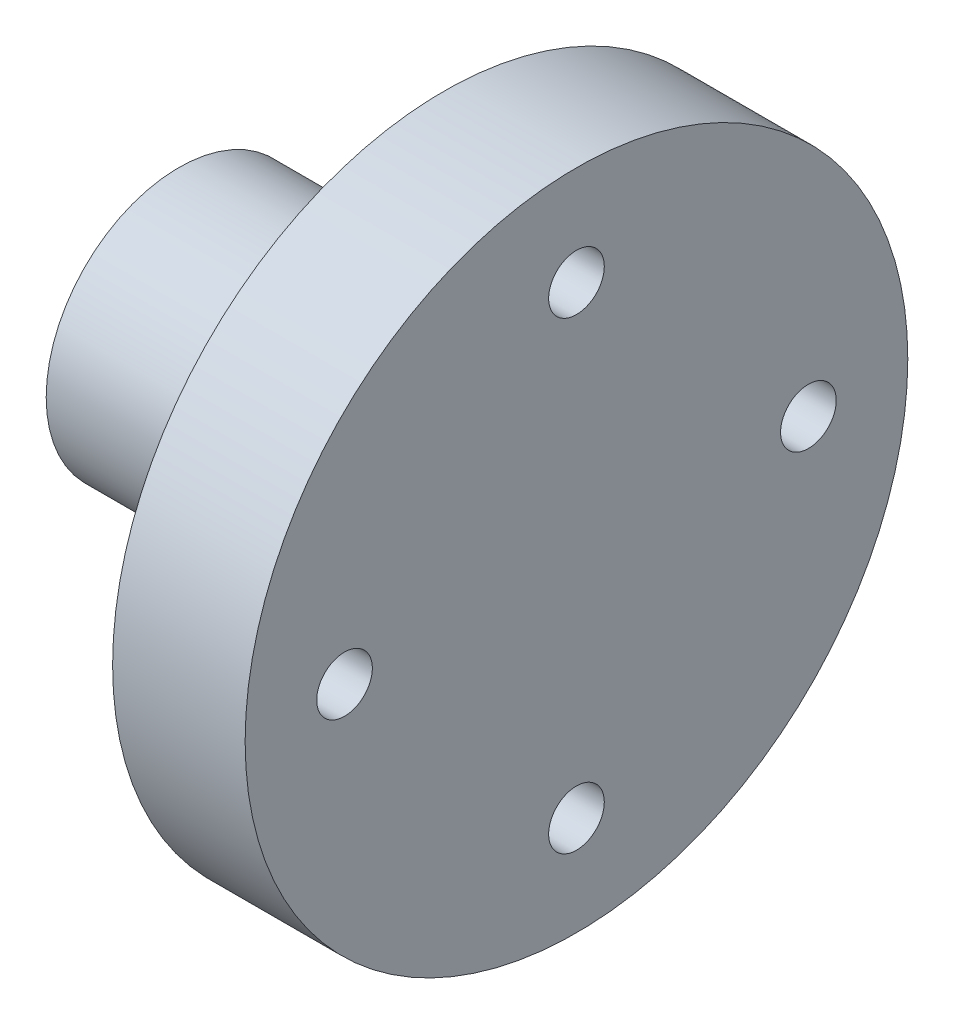
from build123d import *

# Parameters (mm, degrees)
CUT_EXTRUDE1_DEPTH = 20
SKETCH3_R          = 2.1
CUT_EXTRUDE2_DEPTH = 10


with BuildPart() as part:
    # Sketch1 → Revolve1 (revolve)
    with BuildSketch(Plane(origin=(0, 0, 0), x_dir=(1, 0, 0), z_dir=(0, 1, 0)), mode=Mode.PRIVATE) as revolve1_sk:
        Polygon((26.693713361, 0), (26.693713361, 10.0105), (46.693713361, 10.0105), (46.693713361, 25), (56.693713361, 25), (56.693713361, 0), align=None)
    revolve(revolve1_sk.sketch.rotate(Axis((26.693713361, 0, 0), (1, 0, 0)), 180), axis=Axis((26.693713361, 0, 0), (1, 0, 0)))

    # Sketch2 → Cut-Extrude1 (cut)
    with BuildSketch(Plane.ZY.offset(-26.693713361)):
        with BuildLine():
            ThreePointArc((1.5, 4.769696007), (0, 5), (-1.5, 4.769696007))
            Line((-1.5, 4.769696007), (-1.5, 3.57))
            Line((-1.5, 3.57), (1.5, 3.57))
            Line((1.5, 3.57), (1.5, 4.769696007))
        make_face()
        with BuildLine():
            Line((-1.5, 3.57), (-1.5, 4.769696007))
            ThreePointArc((-1.5, 4.769696007), (-2.958039892, -4.031128874), (5, 0))
            ThreePointArc((5, 0), (4.031128874, 2.958039892), (1.5, 4.769696007))
            Line((1.5, 4.769696007), (1.5, 3.57))
            Line((1.5, 3.57), (-1.5, 3.57))
        make_face()
        with BuildLine():
            Line((1.5, 6.43), (-1.5, 6.43))
            Line((-1.5, 6.43), (-1.5, 4.769696007))
            ThreePointArc((-1.5, 4.769696007), (0, 5), (1.5, 4.769696007))
            Line((1.5, 4.769696007), (1.5, 6.43))
        make_face()
    extrude(amount=-CUT_EXTRUDE1_DEPTH, mode=Mode.SUBTRACT)

    # Sketch3 → Cut-Extrude2 (cut)
    with BuildSketch(Plane(origin=(56.693713361, 0, 0), x_dir=(0, 0, -1), z_dir=(1, 0, 0))):
        with Locations((0, 17.5)):
            Circle(SKETCH3_R)
        with Locations((17.5, 0)):
            Circle(SKETCH3_R)
        with Locations((0, -17.5)):
            Circle(SKETCH3_R)
        with Locations((-17.5, 0)):
            Circle(SKETCH3_R)
    extrude(amount=-CUT_EXTRUDE2_DEPTH, mode=Mode.SUBTRACT)


solid = part.part
